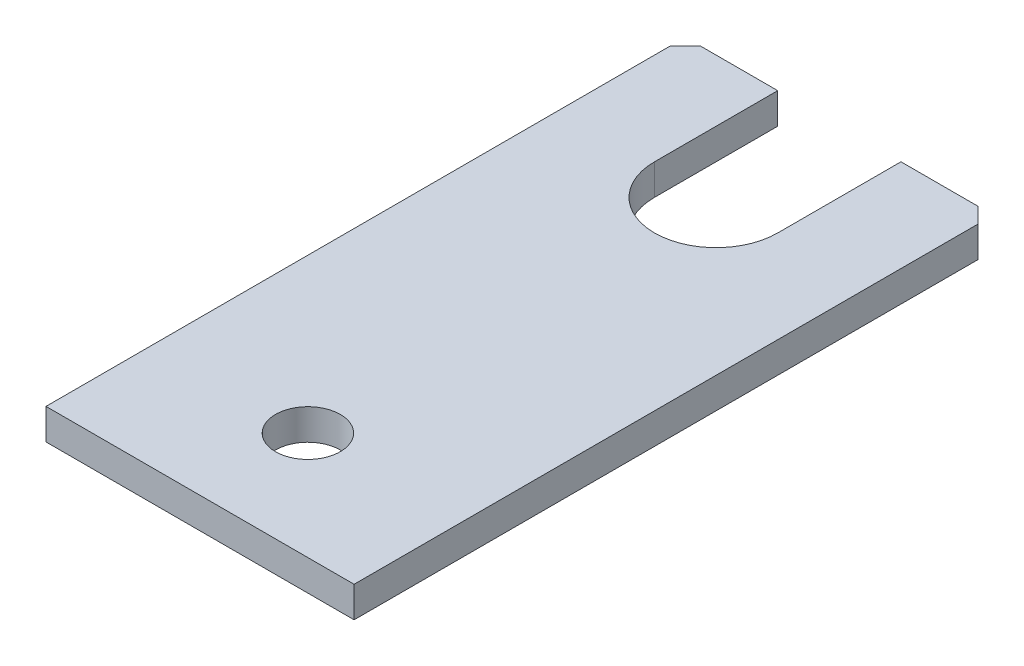
from build123d import *

# Parameters (mm, degrees)
SKETCH_1_R            = 1
EXTRUDE_1_DEPTH       = 2
HOLE_WIZARD_M51_D     = 4.2
HOLE_WIZARD_M51_DEPTH = 14
HOLE_WIZARD_M51_TIP   = 1.2618073


with BuildPart() as part:
    # Эскиз1 → Бобышка-Вытянуть1 (new body)
    with BuildSketch(Plane(origin=(0, 0, 0), x_dir=(1, 0, 0), z_dir=(0, 1, 0))):
        with BuildLine():
            Line((0, 0), (20, 0))
            Line((20, 0), (20, 40.5))
            Line((20, 40.5), (19, 41.5))
            Line((19, 41.5), (14, 41.5))
            Line((14, 41.5), (14, 33.5))
            ThreePointArc((14, 33.5), (10, 29.5), (6, 33.5))
            Line((6, 33.5), (6, 41.5))
            Line((6, 41.5), (1, 41.5))
            Line((1, 41.5), (0, 40.5))
            Line((0, 40.5), (0, 0))
        make_face()
        with Locations(Location((10, 7, 0), (0, 0, 270))):
            Circle(SKETCH_1_R, mode=Mode.SUBTRACT)
    extrude(amount=EXTRUDE_1_DEPTH)

    # Отверстие обработанное метчиком M51
    with Locations(Plane(origin=(0, 2, 0), x_dir=(1, 0, 0), z_dir=(0, 1, 0))):
        with Locations((10, 7)):
            Hole(HOLE_WIZARD_M51_D / 2, depth=HOLE_WIZARD_M51_DEPTH)
            with Locations((0, 0, -(HOLE_WIZARD_M51_DEPTH + HOLE_WIZARD_M51_TIP / 2))):  # 118° drill point
                Cone(0, HOLE_WIZARD_M51_D / 2, HOLE_WIZARD_M51_TIP, mode=Mode.SUBTRACT)


solid = part.part
